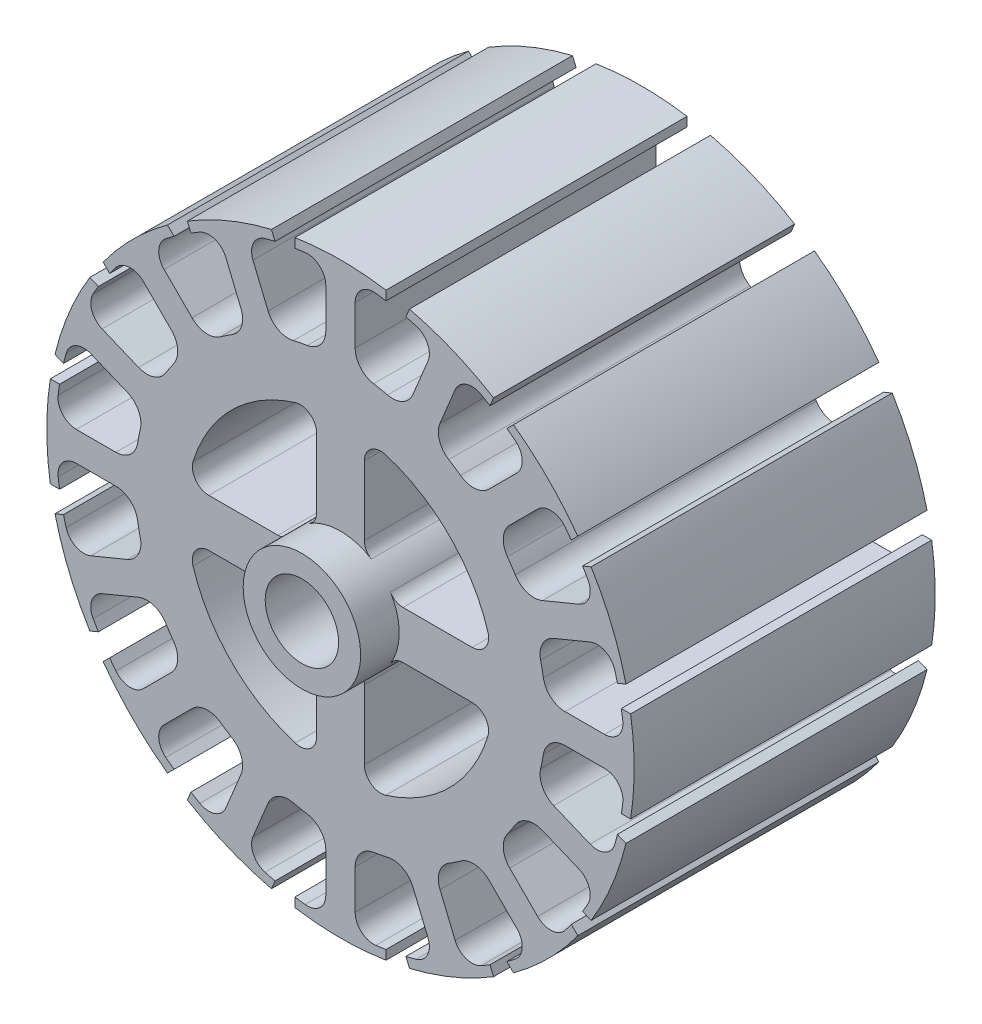
from build123d import *

# Parameters (mm, degrees)
ENL_V_MAT_EXTRU_1_DEPTH      = 77.5
R_P_TITION_CIRCULAIRE1_COUNT = 16
ENL_V_MAT_EXTRU_2_DEPTH      = 77.5
R_P_TITION_CIRCULAIRE2_COUNT = 4


with BuildPart() as part:
    # Esquisse1 → Révolution1 (revolve)
    with BuildSketch(Plane(origin=(0, 0, 0), x_dir=(0, 0, -1), z_dir=(1, 0, 0))):
        Polygon((-46.25, 40), (-46.25, 8), (-51.5, 8), (-51.5, 5), (0, 5), (0, 8), (-5.25, 8), (-5.25, 40), align=None)
    revolve(axis=Axis((0, 0, 0), (0, 0, 1)))

    # Esquisse3 → Enlèv. mat.-Extru.1 (cut, through all)
    with BuildSketch(Plane.XY):
        with BuildLine():
            Line((-6.2, 39.516579), (-6.2, 38.250784))
            ThreePointArc((-6.2, 38.250784), (-5.506076, 38.35682), (-4.810345, 38.450268))
            ThreePointArc((-4.810345, 38.450268), (-2.845591, 37.843887), (-2, 35.969605))
            Line((-2, 35.969605), (-2, 30.594117))
            ThreePointArc((-2, 30.594117), (-2.713998, 28.651389), (-4.516129, 27.633396))
            ThreePointArc((-4.516129, 27.633396), (-5.462529, 27.461988), (-6.402484, 27.258177))
            ThreePointArc((-6.402484, 27.258177), (-8.457005, 27.509034), (-9.860103, 29.030645))
            Line((-9.860103, 29.030645), (-11.917213, 33.996949))
            ThreePointArc((-11.917213, 33.996949), (-11.853245, 36.052153), (-10.270101, 37.364255))
            ThreePointArc((-10.270101, 37.364255), (-9.591569, 37.544165), (-8.909888, 37.711754))
            Line((-8.909888, 37.711754), (-9.394287, 38.881196))
            ThreePointArc((-9.394287, 38.881196), (-7.803613, 39.231411), (-6.2, 39.516579))
        make_face()
    enl_v_mat_extru_1 = extrude(amount=ENL_V_MAT_EXTRU_1_DEPTH, mode=Mode.SUBTRACT)

    # Répétition circulaire1: Enlèv. mat.-Extru.1 ×16 about axis
    r_p_tition_circulaire1_axis = Axis((0, 0, 0), (0, 0, 1))
    for i in range(1, R_P_TITION_CIRCULAIRE1_COUNT):
        add(enl_v_mat_extru_1.rotate(r_p_tition_circulaire1_axis, i * 360 / R_P_TITION_CIRCULAIRE1_COUNT), mode=Mode.SUBTRACT)

    # Esquisse4 → Enlèv. mat.-Extru.2 (cut, through all)
    with BuildSketch(Plane.XY):
        with BuildLine():
            Line((-3.25, 17.925192), (-3.25, 8.511022))
            ThreePointArc((-3.25, 8.511022), (-3.503575, 7.536343), (-4.2, 6.808818))
            ThreePointArc((-4.2, 6.808818), (-5.656854, 5.656854), (-6.808818, 4.2))
            ThreePointArc((-6.808818, 4.2), (-7.536343, 3.503575), (-8.511022, 3.25))
            Line((-8.511022, 3.25), (-17.925192, 3.25))
            ThreePointArc((-17.925192, 3.25), (-19.734542, 4.162558), (-20.076215, 6.16))
            ThreePointArc((-20.076215, 6.16), (-14.849242, 14.849242), (-6.16, 20.076215))
            ThreePointArc((-6.16, 20.076215), (-4.162558, 19.734542), (-3.25, 17.925192))
        make_face()
    enl_v_mat_extru_2 = extrude(amount=ENL_V_MAT_EXTRU_2_DEPTH, mode=Mode.SUBTRACT)

    # Répétition circulaire2: Enlèv. mat.-Extru.2 ×4 about axis
    r_p_tition_circulaire2_axis = Axis((0, 0, 0), (0, 0, 1))
    for i in range(1, R_P_TITION_CIRCULAIRE2_COUNT):
        add(enl_v_mat_extru_2.rotate(r_p_tition_circulaire2_axis, i * 360 / R_P_TITION_CIRCULAIRE2_COUNT), mode=Mode.SUBTRACT)


solid = part.part
